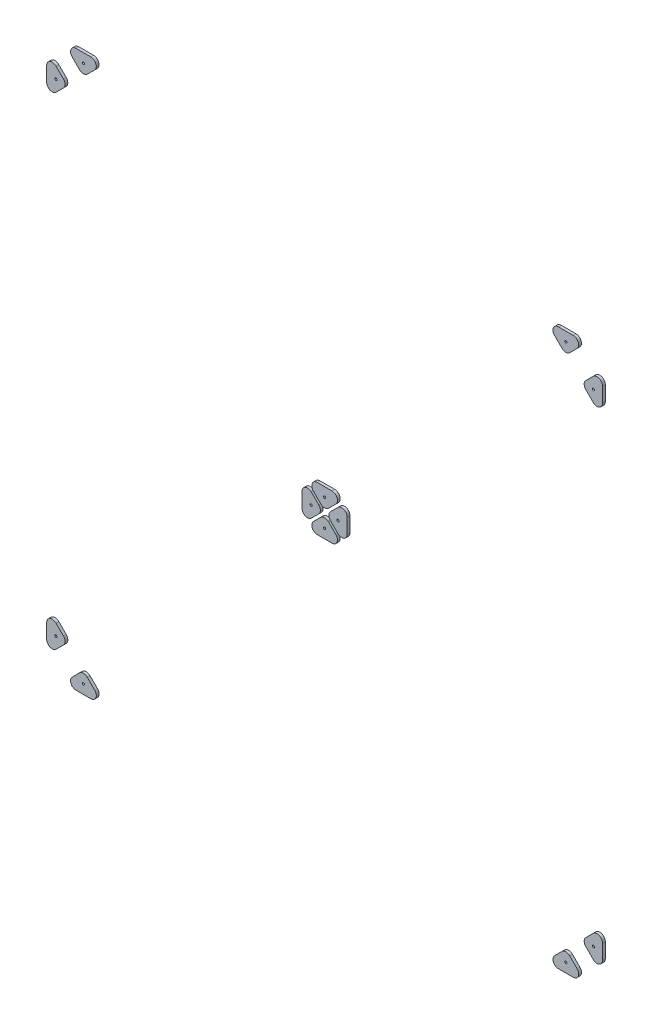
from build123d import *

# Parameters (mm, degrees)
SKETCH1_R              = 2.4
BOSS_EXTRUDE1_DEPTH    = 6
BOSS_EXTRUDE1_2_DEPTH  = 6
BOSS_EXTRUDE1_3_DEPTH  = 6
BOSS_EXTRUDE1_4_DEPTH  = 6
BOSS_EXTRUDE1_5_DEPTH  = 6
BOSS_EXTRUDE1_6_DEPTH  = 6
BOSS_EXTRUDE1_7_DEPTH  = 6
BOSS_EXTRUDE1_8_DEPTH  = 6
BOSS_EXTRUDE1_9_DEPTH  = 6
BOSS_EXTRUDE1_10_DEPTH = 6
BOSS_EXTRUDE1_11_DEPTH = 6
BOSS_EXTRUDE1_12_DEPTH = 6


with BuildPart() as part:
    # Sketch1 → Boss-Extrude1 (new body)
    with BuildSketch(Plane.XY):
        with BuildLine():
            Line((549.514718626, -584.514718626), (533.485281374, -568.485281374))
            ThreePointArc((533.485281374, -568.485281374), (525, -564.970562748), (516.514718626, -568.485281374))
            Line((516.514718626, -568.485281374), (500.485281374, -584.514718626))
            ThreePointArc((500.485281374, -584.514718626), (497.884008358, -597.592201188), (508.970562748, -605))
            Line((508.970562748, -605), (541.029437252, -605))
            ThreePointArc((541.029437252, -605), (552.115991642, -597.592201188), (549.514718626, -584.514718626))
        make_face()
        with Locations((525, -585)):
            Circle(SKETCH1_R, mode=Mode.SUBTRACT)
    extrude(amount=-BOSS_EXTRUDE1_DEPTH)


with BuildPart() as body_2:
    # Sketch1 → Boss-Extrude1 2 (new body)
    with BuildSketch(Plane.XY):
        with BuildLine():
            Line((605, -508.970562748), (605, -541.029437252))
            ThreePointArc((605, -541.029437252), (597.592201188, -552.115991642), (584.514718626, -549.514718626))
            Line((584.514718626, -549.514718626), (568.485281374, -533.485281374))
            ThreePointArc((568.485281374, -533.485281374), (564.970562748, -525), (568.485281374, -516.514718626))
            Line((568.485281374, -516.514718626), (584.514718626, -500.485281374))
            ThreePointArc((584.514718626, -500.485281374), (597.592201188, -497.884008358), (605, -508.970562748))
        make_face()
        with Locations(Location((585, -525, 0), (0, 0, 180))):
            Circle(SKETCH1_R, mode=Mode.SUBTRACT)
    extrude(amount=-BOSS_EXTRUDE1_2_DEPTH)


with BuildPart() as body_3:
    # Sketch1 → Boss-Extrude1 3 (new body)
    with BuildSketch(Plane.XY):
        with BuildLine():
            Line((-584.514718626, -549.514718626), (-568.485281374, -533.485281374))
            ThreePointArc((-568.485281374, -533.485281374), (-564.970562748, -525), (-568.485281374, -516.514718626))
            Line((-568.485281374, -516.514718626), (-584.514718626, -500.485281374))
            ThreePointArc((-584.514718626, -500.485281374), (-597.592201188, -497.884008358), (-605, -508.970562748))
            Line((-605, -508.970562748), (-605, -541.029437252))
            ThreePointArc((-605, -541.029437252), (-597.592201188, -552.115991642), (-584.514718626, -549.514718626))
        make_face()
        with Locations((-585, -525)):
            Circle(SKETCH1_R, mode=Mode.SUBTRACT)
    extrude(amount=-BOSS_EXTRUDE1_3_DEPTH)


with BuildPart() as body_4:
    # Sketch1 → Boss-Extrude1 4 (new body)
    with BuildSketch(Plane.XY):
        with BuildLine():
            Line((-508.970562748, -605), (-541.029437252, -605))
            ThreePointArc((-541.029437252, -605), (-552.115991642, -597.592201188), (-549.514718626, -584.514718626))
            Line((-549.514718626, -584.514718626), (-533.485281374, -568.485281374))
            ThreePointArc((-533.485281374, -568.485281374), (-525, -564.970562748), (-516.514718626, -568.485281374))
            Line((-516.514718626, -568.485281374), (-500.485281374, -584.514718626))
            ThreePointArc((-500.485281374, -584.514718626), (-497.884008358, -597.592201188), (-508.970562748, -605))
        make_face()
        with Locations(Location((-525, -585, 0), (0, 0, 180))):
            Circle(SKETCH1_R, mode=Mode.SUBTRACT)
    extrude(amount=-BOSS_EXTRUDE1_4_DEPTH)


with BuildPart() as body_5:
    # Sketch1 → Boss-Extrude1 5 (new body)
    with BuildSketch(Plane.XY):
        with BuildLine():
            Line((-549.514718626, 584.514718626), (-533.485281374, 568.485281374))
            ThreePointArc((-533.485281374, 568.485281374), (-525, 564.970562748), (-516.514718626, 568.485281374))
            Line((-516.514718626, 568.485281374), (-500.485281374, 584.514718626))
            ThreePointArc((-500.485281374, 584.514718626), (-497.884008358, 597.592201188), (-508.970562748, 605))
            Line((-508.970562748, 605), (-541.029437252, 605))
            ThreePointArc((-541.029437252, 605), (-552.115991642, 597.592201188), (-549.514718626, 584.514718626))
        make_face()
        with Locations((-525, 585)):
            Circle(SKETCH1_R, mode=Mode.SUBTRACT)
    extrude(amount=-BOSS_EXTRUDE1_5_DEPTH)


with BuildPart() as body_6:
    # Sketch1 → Boss-Extrude1 6 (new body)
    with BuildSketch(Plane.XY):
        with BuildLine():
            Line((-605, 508.970562748), (-605, 541.029437252))
            ThreePointArc((-605, 541.029437252), (-597.592201188, 552.115991642), (-584.514718626, 549.514718626))
            Line((-584.514718626, 549.514718626), (-568.485281374, 533.485281374))
            ThreePointArc((-568.485281374, 533.485281374), (-564.970562748, 525), (-568.485281374, 516.514718626))
            Line((-568.485281374, 516.514718626), (-584.514718626, 500.485281374))
            ThreePointArc((-584.514718626, 500.485281374), (-597.592201188, 497.884008358), (-605, 508.970562748))
        make_face()
        with Locations(Location((-585, 525, 0), (0, 0, 180))):
            Circle(SKETCH1_R, mode=Mode.SUBTRACT)
    extrude(amount=-BOSS_EXTRUDE1_6_DEPTH)


with BuildPart() as body_7:
    # Sketch1 → Boss-Extrude1 7 (new body)
    with BuildSketch(Plane.XY):
        with BuildLine():
            Line((584.514718626, 549.514718626), (568.485281374, 533.485281374))
            ThreePointArc((568.485281374, 533.485281374), (564.970562748, 525), (568.485281374, 516.514718626))
            Line((568.485281374, 516.514718626), (584.514718626, 500.485281374))
            ThreePointArc((584.514718626, 500.485281374), (597.592201188, 497.884008358), (605, 508.970562748))
            Line((605, 508.970562748), (605, 541.029437252))
            ThreePointArc((605, 541.029437252), (597.592201188, 552.115991642), (584.514718626, 549.514718626))
        make_face()
        with Locations((585, 525)):
            Circle(SKETCH1_R, mode=Mode.SUBTRACT)
    extrude(amount=-BOSS_EXTRUDE1_7_DEPTH)


with BuildPart() as body_8:
    # Sketch1 → Boss-Extrude1 8 (new body)
    with BuildSketch(Plane.XY):
        with BuildLine():
            Line((508.970562748, 605), (541.029437252, 605))
            ThreePointArc((541.029437252, 605), (552.115991642, 597.592201188), (549.514718626, 584.514718626))
            Line((549.514718626, 584.514718626), (533.485281374, 568.485281374))
            ThreePointArc((533.485281374, 568.485281374), (525, 564.970562748), (516.514718626, 568.485281374))
            Line((516.514718626, 568.485281374), (500.485281374, 584.514718626))
            ThreePointArc((500.485281374, 584.514718626), (497.884008358, 597.592201188), (508.970562748, 605))
        make_face()
        with Locations(Location((525, 585, 0), (0, 0, 180))):
            Circle(SKETCH1_R, mode=Mode.SUBTRACT)
    extrude(amount=-BOSS_EXTRUDE1_8_DEPTH)


with BuildPart() as body_9:
    # Sketch1 → Boss-Extrude1 9 (new body)
    with BuildSketch(Plane.XY):
        with BuildLine():
            Line((16.029437252, -49.242640687), (-16.029437252, -49.242640687))
            ThreePointArc((-16.029437252, -49.242640687), (-27.115991642, -41.834841876), (-24.514718626, -28.757359313))
            Line((-24.514718626, -28.757359313), (-8.485281374, -12.727922061))
            ThreePointArc((-8.485281374, -12.727922061), (0, -9.213203436), (8.485281374, -12.727922061))
            Line((8.485281374, -12.727922061), (24.514718626, -28.757359313))
            ThreePointArc((24.514718626, -28.757359313), (27.115991642, -41.834841876), (16.029437252, -49.242640687))
        make_face()
        with Locations((0, -29.242640687)):
            Circle(SKETCH1_R, mode=Mode.SUBTRACT)
    extrude(amount=-BOSS_EXTRUDE1_9_DEPTH)


with BuildPart() as body_10:
    # Sketch1 → Boss-Extrude1 10 (new body)
    with BuildSketch(Plane.XY):
        with BuildLine():
            Line((12.727922061, -8.485281374), (28.757359313, -24.514718626))
            ThreePointArc((28.757359313, -24.514718626), (41.834841876, -27.115991642), (49.242640687, -16.029437252))
            Line((49.242640687, -16.029437252), (49.242640687, 16.029437252))
            ThreePointArc((49.242640687, 16.029437252), (41.834841876, 27.115991642), (28.757359313, 24.514718626))
            Line((28.757359313, 24.514718626), (12.727922061, 8.485281374))
            ThreePointArc((12.727922061, 8.485281374), (9.213203436, 0), (12.727922061, -8.485281374))
        make_face()
        with Locations(Location((29.242640687, 0, 0), (0, 0, 180))):
            Circle(SKETCH1_R, mode=Mode.SUBTRACT)
    extrude(amount=-BOSS_EXTRUDE1_10_DEPTH)


with BuildPart() as body_11:
    # Sketch1 → Boss-Extrude1 11 (new body)
    with BuildSketch(Plane.XY):
        with BuildLine():
            Line((-16.029437252, 49.242640687), (16.029437252, 49.242640687))
            ThreePointArc((16.029437252, 49.242640687), (27.115991642, 41.834841876), (24.514718626, 28.757359313))
            Line((24.514718626, 28.757359313), (8.485281374, 12.727922061))
            ThreePointArc((8.485281374, 12.727922061), (0, 9.213203436), (-8.485281374, 12.727922061))
            Line((-8.485281374, 12.727922061), (-24.514718626, 28.757359313))
            ThreePointArc((-24.514718626, 28.757359313), (-27.115991642, 41.834841876), (-16.029437252, 49.242640687))
        make_face()
        with Locations((0, 29.242640687)):
            Circle(SKETCH1_R, mode=Mode.SUBTRACT)
    extrude(amount=-BOSS_EXTRUDE1_11_DEPTH)


with BuildPart() as body_12:
    # Sketch1 → Boss-Extrude1 12 (new body)
    with BuildSketch(Plane.XY):
        with BuildLine():
            Line((-12.727922061, 8.485281374), (-28.757359313, 24.514718626))
            ThreePointArc((-28.757359313, 24.514718626), (-41.834841876, 27.115991642), (-49.242640687, 16.029437252))
            Line((-49.242640687, 16.029437252), (-49.242640687, -16.029437252))
            ThreePointArc((-49.242640687, -16.029437252), (-41.834841876, -27.115991642), (-28.757359313, -24.514718626))
            Line((-28.757359313, -24.514718626), (-12.727922061, -8.485281374))
            ThreePointArc((-12.727922061, -8.485281374), (-9.213203436, 0), (-12.727922061, 8.485281374))
        make_face()
        with Locations(Location((-29.242640687, 0, 0), (0, 0, 180))):
            Circle(SKETCH1_R, mode=Mode.SUBTRACT)
    extrude(amount=-BOSS_EXTRUDE1_12_DEPTH)


solid = Compound([part.part, body_2.part, body_3.part, body_4.part, body_5.part, body_6.part, body_7.part, body_8.part, body_9.part, body_10.part, body_11.part, body_12.part])
